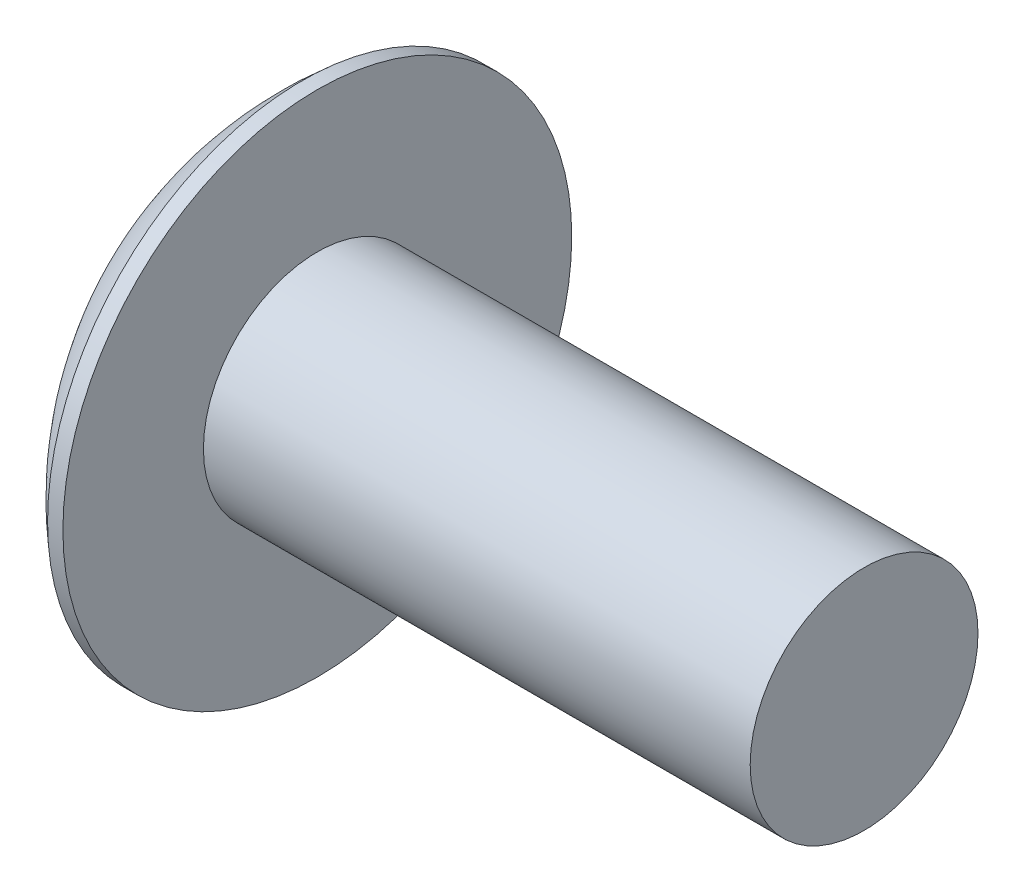
from build123d import *

# Parameters (mm, degrees)
CIRPATTERN1_COUNT = 2
CIRPATTERN1_ANGLE = 90


with BuildPart() as part:
    # BodySke → Base-Revolve (revolve)
    with BuildSketch(Plane.XY, mode=Mode.PRIVATE) as base_revolve_sk:
        with BuildLine():
            Line((4.6482, 3.96875), (4.6482, 8.8646))
            Line((4.6482, 8.8646), (4.113809896, 8.8646))
            ThreePointArc((4.113809896, 8.8646), (1.078560731, 4.886321853), (0, 0))
            Line((0, 0), (23.6982, 0))
            Line((23.6982, 0), (23.6982, 3.96875))
            Line((23.6982, 3.96875), (4.6482, 3.96875))
        make_face()
    revolve(base_revolve_sk.sketch.rotate(Axis((-25.4, 0, 0), (1, 0, 0)), 90), axis=Axis((-25.4, 0, 0), (1, 0, 0)))

    # Sketch3 → Cross section 0
    with BuildSketch(Plane(origin=(0, 0, 0), x_dir=(0, 0, -1), z_dir=(1, 0, 0))):
        with BuildLine():
            Line((0.8509, -4.9657), (-0.8509, -4.9657))
            Line((-0.8509, -4.9657), (-0.8509, 4.9657))
            Line((-0.8509, 4.9657), (0.8509, 4.9657))
            Line((0.8509, 4.9657), (0.8509, -4.9657))
        make_face()
    # Sketch4 → Cross section 1
    with BuildSketch(Plane(origin=(5.7912, 0, 0), x_dir=(0, 0, -1), z_dir=(1, 0, 0))):
        with BuildLine():
            Line((0.42545, -0.42545), (-0.42545, -0.42545))
            Line((-0.42545, -0.42545), (-0.42545, 0.42545))
            Line((-0.42545, 0.42545), (0.42545, 0.42545))
            Line((0.42545, 0.42545), (0.42545, -0.42545))
        make_face()
    cross = loft(mode=Mode.SUBTRACT)

    # CirPattern1: Cross ×2 about axis
    cirpattern1_axis = Axis((0, 0, 0), (1, 0, 0))
    for i in range(1, CIRPATTERN1_COUNT):
        add(cross.rotate(cirpattern1_axis, i * CIRPATTERN1_ANGLE / (CIRPATTERN1_COUNT - 1)), mode=Mode.SUBTRACT)


solid = part.part
